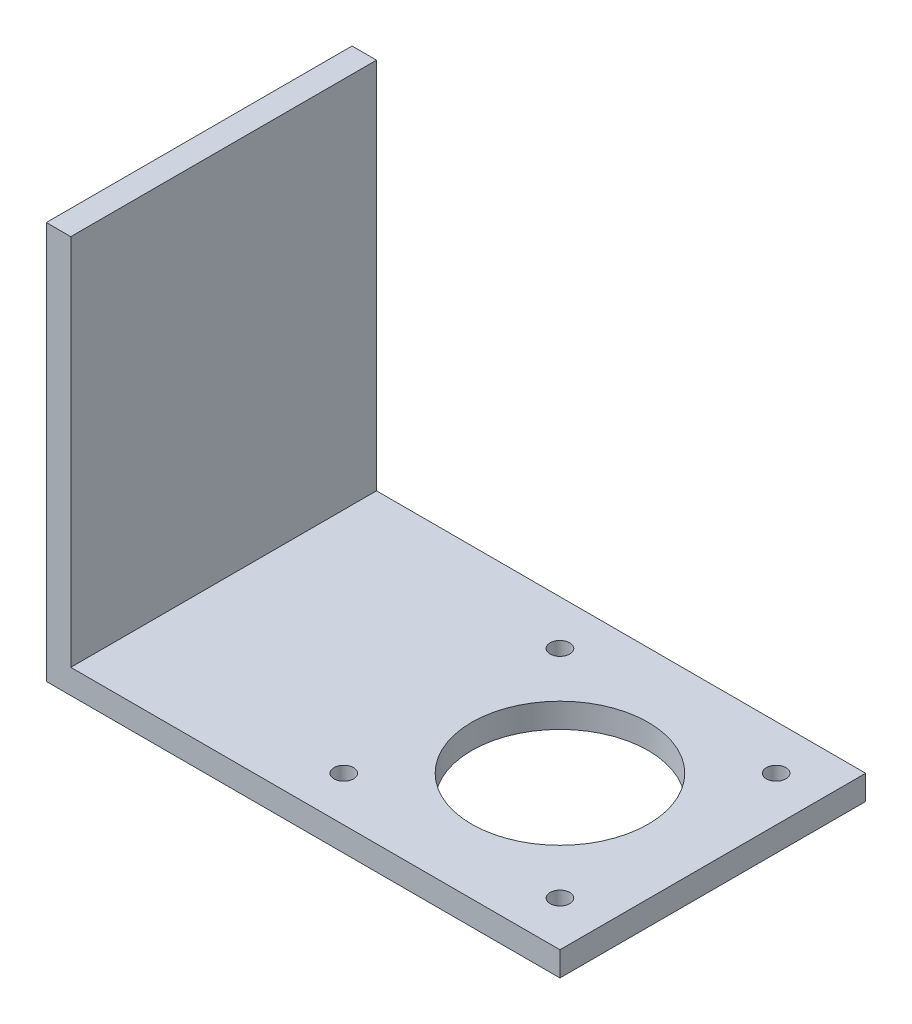
from build123d import *

# Parameters (mm, degrees)
SKETCH_1_W      = 50
SKETCH_1_H      = 50
SKETCH_1_R      = 14.436913374
SKETCH_1_R_2    = 1.6
EXTRUDE_1_DEPTH = 4
SKETCH_2_W      = 31
SKETCH_2_H      = 50
EXTRUDE_2_DEPTH = 4
SKETCH_3_W      = 50
SKETCH_3_H      = 65
EXTRUDE_3_DEPTH = 4


with BuildPart() as part:
    # 草图1 → 凸台-拉伸1 (new body)
    with BuildSketch(Plane(origin=(0, 0, 0), x_dir=(1, 0, 0), z_dir=(0, 1, 0))):
        Rectangle(SKETCH_1_W, SKETCH_1_H)
        with Locations(Location((0, 0, 0), (0, 0, 270))):
            Circle(SKETCH_1_R, mode=Mode.SUBTRACT)
        with Locations(Location((-17.67766953, -17.67766953, 0), (0, 0, 270))):
            Circle(SKETCH_1_R_2, mode=Mode.SUBTRACT)
        with Locations(Location((17.67766953, -17.67766953, 0), (0, 0, 270))):
            Circle(SKETCH_1_R_2, mode=Mode.SUBTRACT)
        with Locations(Location((17.67766953, 17.67766953, 0), (0, 0, 270))):
            Circle(SKETCH_1_R_2, mode=Mode.SUBTRACT)
        with Locations(Location((-17.67766953, 17.67766953, 0), (0, 0, 270))):
            Circle(SKETCH_1_R_2, mode=Mode.SUBTRACT)
    extrude(amount=EXTRUDE_1_DEPTH)

    # 草图2 → 凸台-拉伸2 (add)
    with BuildSketch(Plane(origin=(0, 0, 0), x_dir=(1, 0, 0), z_dir=(0, 1, 0))):
        with Locations((-40.5, 0)):
            Rectangle(SKETCH_2_W, SKETCH_2_H)
    extrude(amount=EXTRUDE_2_DEPTH)

    # 草图3 → 凸台-拉伸3 (add)
    with BuildSketch(Plane.ZY.offset(55)):
        with Locations((0, 32.5)):
            Rectangle(SKETCH_3_W, SKETCH_3_H)
    extrude(amount=EXTRUDE_3_DEPTH)


solid = part.part
